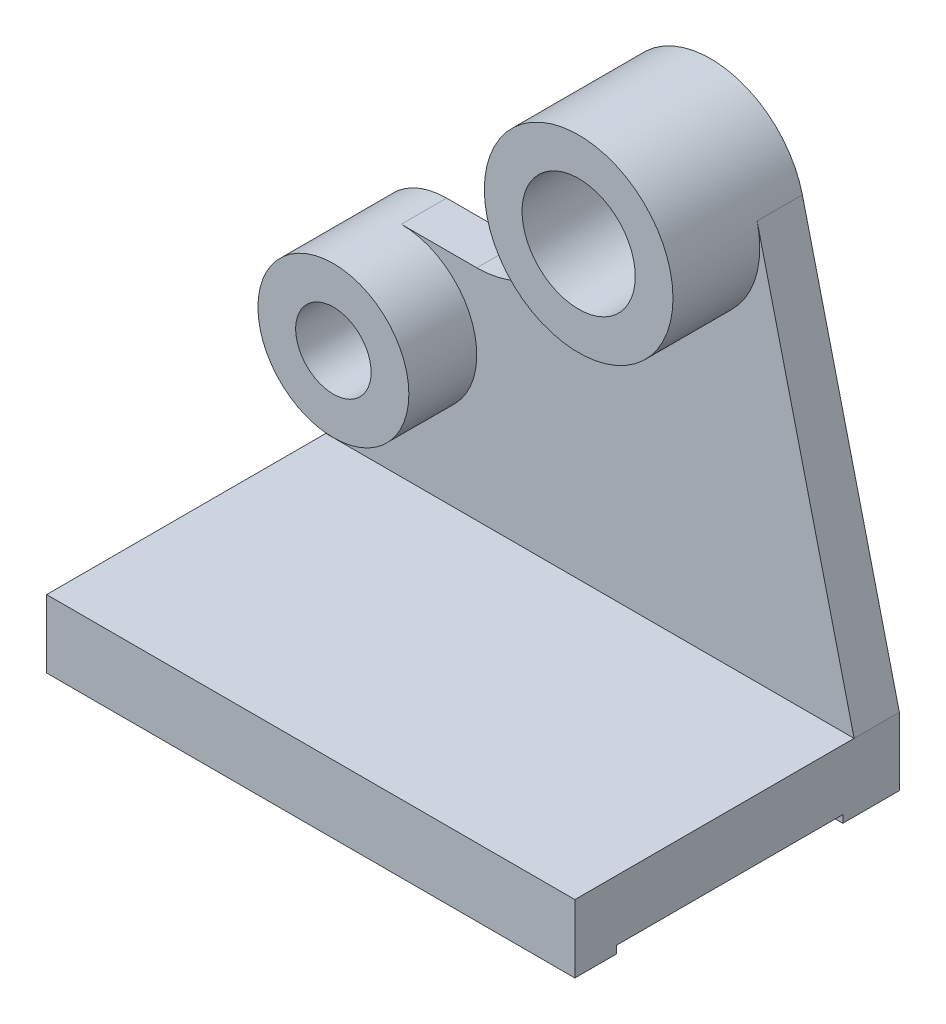
from build123d import *

# Parameters (mm, degrees)
SKETCH1_W           = 140
SKETCH1_H           = 18
BOSS_EXTRUDE1_DEPTH = 86
BOSS_EXTRUDE2_DEPTH = 12
SKETCH1_4_R         = 15
BOSS_EXTRUDE3_DEPTH = 35
SKETCH1_5_R         = 10
BOSS_EXTRUDE4_DEPTH = 30
CUT_EXTRUDE1_REACH  = 219.819
SKETCH4_W           = 60
SKETCH4_H           = 2


with BuildPart() as part:
    # Sketch1 → Boss-Extrude1 (new body)
    with BuildSketch(Plane.XY):
        with Locations((-20, 9)):
            Rectangle(SKETCH1_W, SKETCH1_H)
    extrude(amount=BOSS_EXTRUDE1_DEPTH)

    # Sketch1<3> → Boss-Extrude2 (add)
    with BuildSketch(Plane.XY):
        with BuildLine():
            Line((-90, 18), (50, 18))
            Line((50, 18), (24.294494718, 123.897247359))
            ThreePointArc((24.294494718, 123.897247359), (24.822997079, 120.969649142), (25, 118))
            ThreePointArc((25, 118), (0, 93), (-25, 118))
            Line((-25, 118), (-25, 101))
            ThreePointArc((-25, 101), (-32.32233047, 83.32233047), (-50, 76))
            Line((-50, 76), (-70, 76))
            ThreePointArc((-70, 76), (-55.857864376, 70.142135624), (-50, 56))
            ThreePointArc((-50, 56), (-70, 36), (-90, 56))
            Line((-90, 56), (-90, 18))
        make_face()
    extrude(amount=BOSS_EXTRUDE2_DEPTH)

    # Sketch1<4> → Boss-Extrude3 (add)
    with BuildSketch(Plane.XY):
        with BuildLine():
            ThreePointArc((25, 118), (24.822997079, 120.969649142), (24.294494718, 123.897247359))
            ThreePointArc((24.294494718, 123.897247359), (-2.969649142, 142.822997079), (-25, 118))
            ThreePointArc((-25, 118), (0, 93), (25, 118))
        make_face()
        with Locations((0, 118)):
            Circle(SKETCH1_4_R, mode=Mode.SUBTRACT)
    extrude(amount=BOSS_EXTRUDE3_DEPTH)

    # Sketch1<5> → Boss-Extrude4 (add)
    with BuildSketch(Plane.XY):
        with BuildLine():
            ThreePointArc((-70, 76), (-84.142135624, 70.142135624), (-90, 56))
            ThreePointArc((-90, 56), (-70, 36), (-50, 56))
            ThreePointArc((-50, 56), (-55.857864376, 70.142135624), (-70, 76))
        make_face()
        with Locations((-70, 56)):
            Circle(SKETCH1_5_R, mode=Mode.SUBTRACT)
    extrude(amount=BOSS_EXTRUDE4_DEPTH)

    # Sketch4 → Cut-Extrude1 (cut, up to next)
    with BuildSketch(Plane(origin=(50, 0, 0), x_dir=(0, 0, -1), z_dir=(1, 0, 0)), mode=Mode.PRIVATE) as cut_extrude1_sk1:
        with Locations((-45, 1)):
            Rectangle(SKETCH4_W, SKETCH4_H)
    cut_extrude1_tool1 = extrude(cut_extrude1_sk1.sketch, amount=-CUT_EXTRUDE1_REACH, mode=Mode.PRIVATE) & part.part
    add(cut_extrude1_tool1.solids().sort_by_distance((50, 1, 45))[0], mode=Mode.SUBTRACT)


solid = part.part
